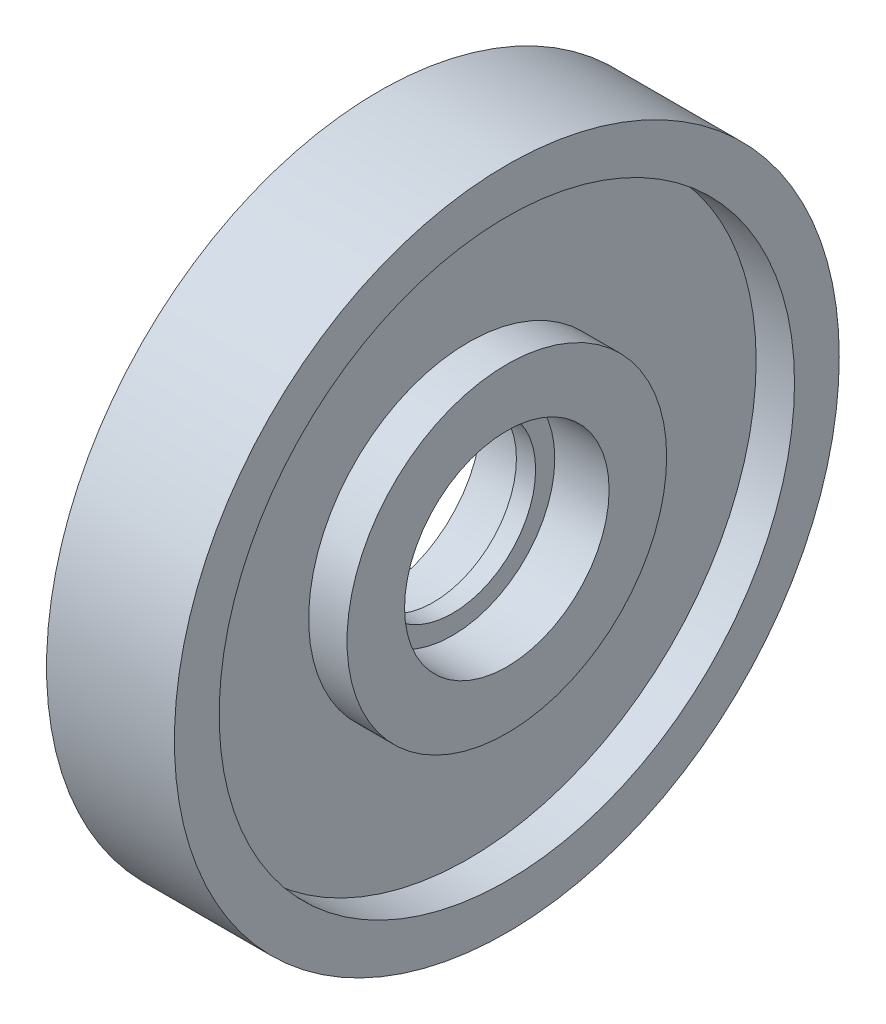
from build123d import *

# Parameters (mm, degrees)
SKETCH1_R           = 26
SKETCH1_R_2         = 8
BOSS_EXTRUDE1_DEPTH = 10
SKETCH2_R           = 8
SKETCH2_R_2         = 6.5
BOSS_EXTRUDE2_DEPTH = 0.75
SKETCH3_R           = 22.5
SKETCH3_R_2         = 12.5
CUT_EXTRUDE1_DEPTH  = 3


with BuildPart() as part:
    # Sketch1 → Boss-Extrude1 (new body)
    with BuildSketch(Plane(origin=(0, 0, 0), x_dir=(0, 0, -1), z_dir=(1, 0, 0))):
        Circle(SKETCH1_R)
        Circle(SKETCH1_R_2, mode=Mode.SUBTRACT)
    extrude(amount=BOSS_EXTRUDE1_DEPTH)

    # Sketch2 → Boss-Extrude2 (add, symmetric)
    with BuildSketch(Plane(origin=(5, 0, 0), x_dir=(0, 0, -1), z_dir=(1, 0, 0))):
        Circle(SKETCH2_R)
        Circle(SKETCH2_R_2, mode=Mode.SUBTRACT)
    extrude(amount=BOSS_EXTRUDE2_DEPTH, both=True)

    # Sketch3 → Cut-Extrude1 (cut)
    with BuildSketch(Plane(origin=(10, 0, 0), x_dir=(0, 0, -1), z_dir=(1, 0, 0))):
        Circle(SKETCH3_R)
        Circle(SKETCH3_R_2, mode=Mode.SUBTRACT)
    cut_extrude1 = extrude(amount=-CUT_EXTRUDE1_DEPTH, mode=Mode.SUBTRACT)

    # Mirror1: Cut-Extrude1 across plane
    add(cut_extrude1.mirror(Plane(origin=(5, 0, 0), x_dir=(0, 0, 1), z_dir=(1, 0, 0))), mode=Mode.SUBTRACT)


solid = part.part
